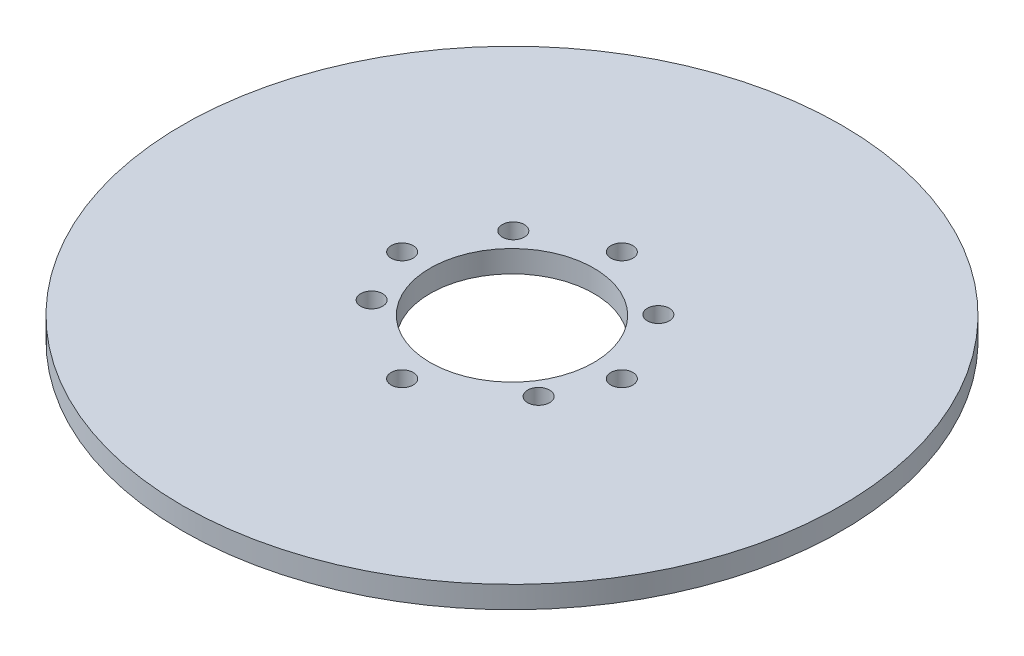
from build123d import *

# Parameters (mm, degrees)
SKETCH1_R           = 150
SKETCH1_R_2         = 5
SKETCH1_R_3         = 37.25
BOSS_EXTRUDE1_DEPTH = 10


with BuildPart() as part:
    # Sketch1 → Boss-Extrude1 (new body)
    with BuildSketch(Plane(origin=(0, 0, 0), x_dir=(1, 0, 0), z_dir=(0, 1, 0))):
        with Locations(Location((0, -3, 0), (0, 0, 270))):
            Circle(SKETCH1_R)
        with Locations(Location((-33, 30.594117082, 0), (0, 0, 270))):
            Circle(SKETCH1_R_2, mode=Mode.SUBTRACT)
        with Locations(Location((33, 30.594117082, 0), (0, 0, 270))):
            Circle(SKETCH1_R_2, mode=Mode.SUBTRACT)
        with Locations(Location((38, -28.896134221, 0), (0, 0, 270))):
            Circle(SKETCH1_R_2, mode=Mode.SUBTRACT)
        with Locations(Location((-38, -28.896134221, 0), (0, 0, 270))):
            Circle(SKETCH1_R_2, mode=Mode.SUBTRACT)
        with Locations(Location((0, -3, 0), (0, 0, 270))):
            Circle(SKETCH1_R_3, mode=Mode.SUBTRACT)
        with Locations(Location((0, 47, 0), (0, 0, 270))):
            Circle(SKETCH1_R_2, mode=Mode.SUBTRACT)
        with Locations(Location((50, -3, 0), (0, 0, 270))):
            Circle(SKETCH1_R_2, mode=Mode.SUBTRACT)
        with Locations(Location((0, -53, 0), (0, 0, 270))):
            Circle(SKETCH1_R_2, mode=Mode.SUBTRACT)
        with Locations(Location((-50, -3, 0), (0, 0, 270))):
            Circle(SKETCH1_R_2, mode=Mode.SUBTRACT)
    extrude(amount=BOSS_EXTRUDE1_DEPTH)


solid = part.part
